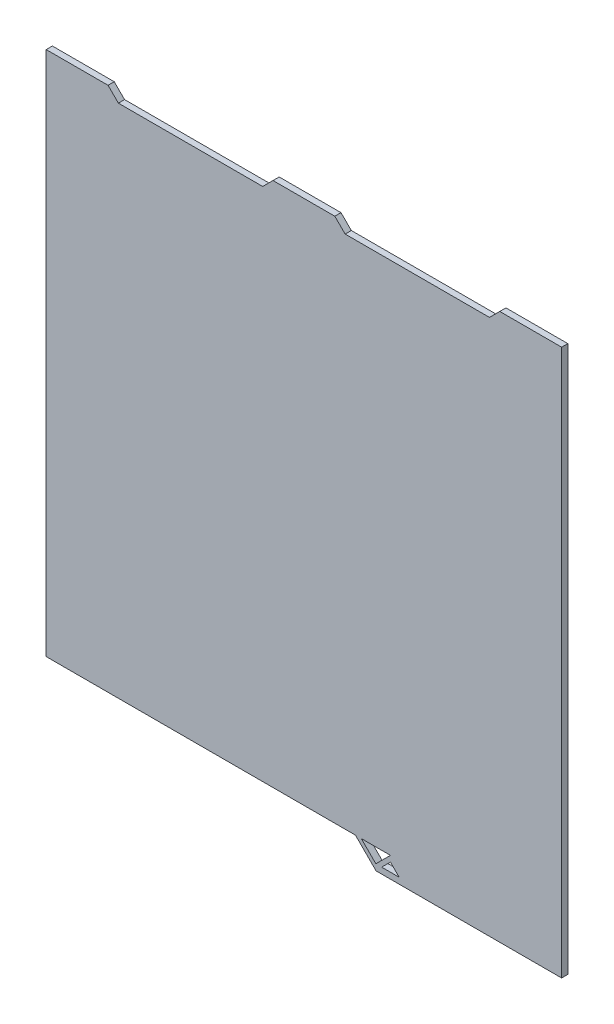
from build123d import *

# Parameters (mm, degrees)
BOSS_EXTRUDE5_DEPTH = 3
CUT_EXTRUDE1_DEPTH  = 9


with BuildPart() as part:
    # Sketch3 → Boss-Extrude5 (new body)
    with BuildSketch(Plane.XY):
        Polygon((-125, 125), (-125, -125), (25, -125), (35, -135), (125, -135), (125, -125), (125, 125), (125, 130), (95, 130), (90, 125), (20, 125), (15, 130), (-15, 130), (-20, 125), (-90, 125), (-95, 130), (-125, 130), align=None)
    extrude(amount=-BOSS_EXTRUDE5_DEPTH)

    # Sketch4 → Cut-Extrude1 (cut)
    with BuildSketch(Plane.XY):
        Polygon((34.899494937, -132.071067812), (41.970562748, -125), (27.828427125, -125), align=None)
        Polygon((37.727922061, -132.071067812), (46.213203436, -132.071067812), (41.970562748, -127.828427125), align=None)
    extrude(amount=-CUT_EXTRUDE1_DEPTH, mode=Mode.SUBTRACT)


solid = part.part
